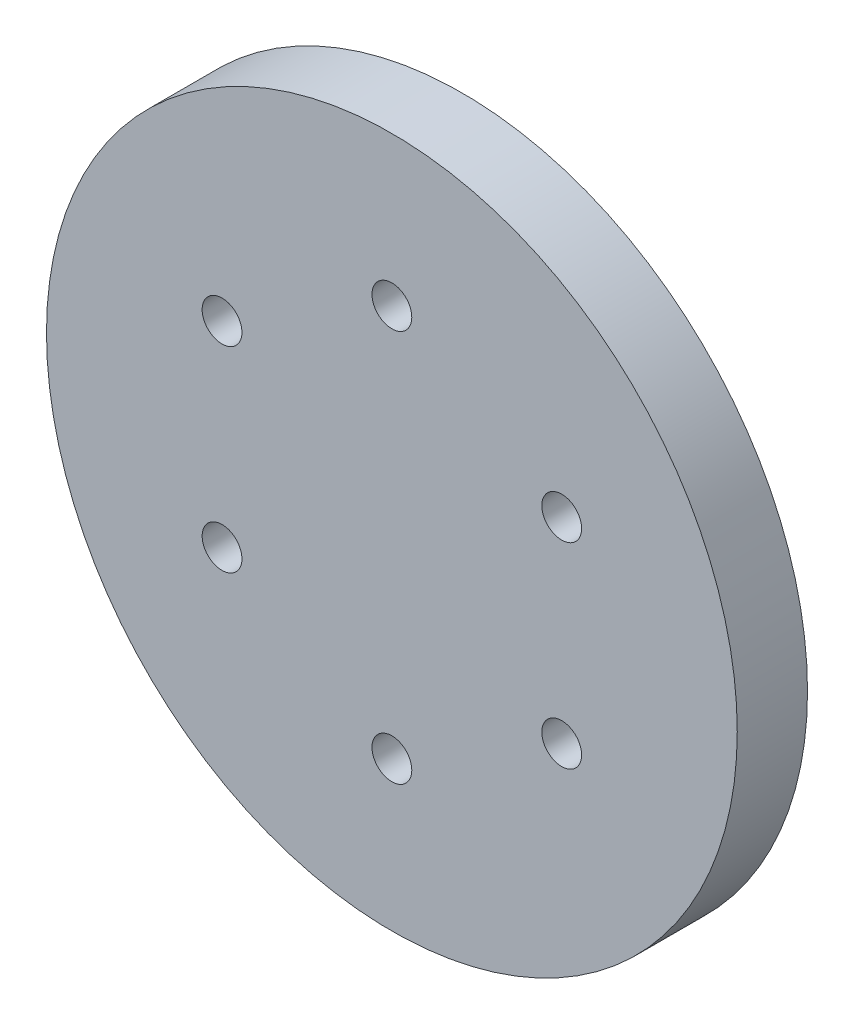
from build123d import *

# Parameters (mm, degrees)
SKETCH_1_R      = 27.6
SKETCH_1_R_2    = 1.7
EXTRUDE_1_DEPTH = 3
EXTRUDE_START   = -6
SKETCH_2_R      = 29.5
SKETCH_2_R_2    = 27.6
EXTRUDE_2_DEPTH = 6


with BuildPart() as part:
    # 草图1 → 凸台-拉伸1 (new body)
    with BuildSketch(Plane.XY):
        Circle(SKETCH_1_R)
        with Locations((-14.505925513, -8.375)):
            Circle(SKETCH_1_R_2, mode=Mode.SUBTRACT)
        with Locations((-14.505925513, 8.375)):
            Circle(SKETCH_1_R_2, mode=Mode.SUBTRACT)
        with Locations((0, 16.75)):
            Circle(SKETCH_1_R_2, mode=Mode.SUBTRACT)
        with Locations((14.505925513, 8.375)):
            Circle(SKETCH_1_R_2, mode=Mode.SUBTRACT)
        with Locations((14.505925513, -8.375)):
            Circle(SKETCH_1_R_2, mode=Mode.SUBTRACT)
        with Locations((0, -16.75)):
            Circle(SKETCH_1_R_2, mode=Mode.SUBTRACT)
    extrude(amount=EXTRUDE_1_DEPTH)

    # 草图2 → 凸台-拉伸2 (add)
    with BuildSketch(Plane.XY.offset(3).offset(EXTRUDE_START)):
        Circle(SKETCH_2_R)
        Circle(SKETCH_2_R_2, mode=Mode.SUBTRACT)
    extrude(amount=EXTRUDE_2_DEPTH)


solid = part.part
